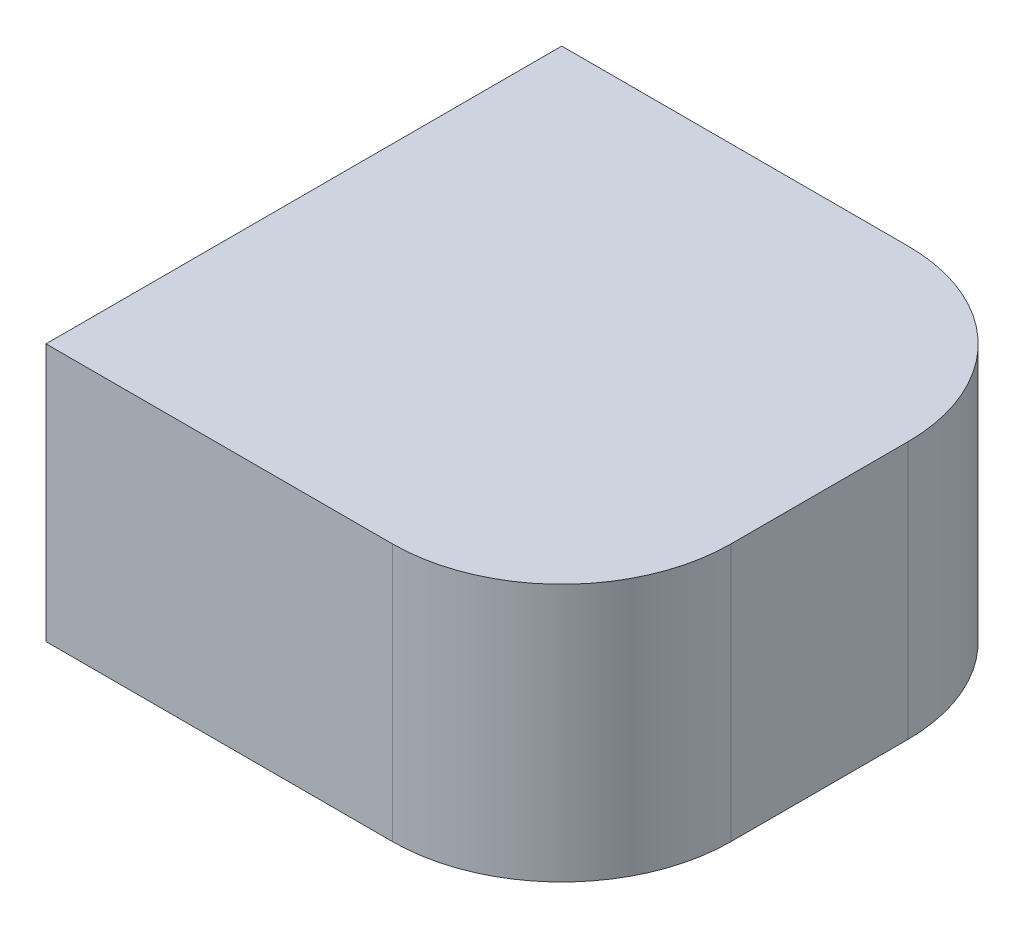
from build123d import *

# Parameters (mm, degrees)
SALIENTE_EXTRUIR1_DEPTH = 35
CROQUIS2_W              = 3
CROQUIS2_H              = 24
CORTAR_EXTRUIR1_DEPTH   = 22


with BuildPart() as part:
    # Croquis1 → Saliente-Extruir1 (new body)
    with BuildSketch(Plane(origin=(0, 0, 0), x_dir=(1, 0, 0), z_dir=(0, 1, 0))):
        with BuildLine():
            Line((-23, 0), (-70, 0))
            Line((-70, 0), (-70, -70))
            Line((-70, -70), (-23, -70))
            ThreePointArc((-23, -70), (-6.736544033, -63.263455967), (0, -47))
            Line((0, -47), (0, -23))
            ThreePointArc((0, -23), (-6.736544033, -6.736544033), (-23, 0))
        make_face()
    extrude(amount=SALIENTE_EXTRUIR1_DEPTH)

    # Croquis2 → Cortar-Extruir1 (cut)
    with BuildSketch(Plane(origin=(0, 0, 0), x_dir=(-1, 0, 0), z_dir=(0, 0, -1))):
        with Locations((66.5, 17.5)):
            Rectangle(CROQUIS2_W, CROQUIS2_H)
    extrude(amount=-CORTAR_EXTRUIR1_DEPTH, mode=Mode.SUBTRACT)


solid = part.part
